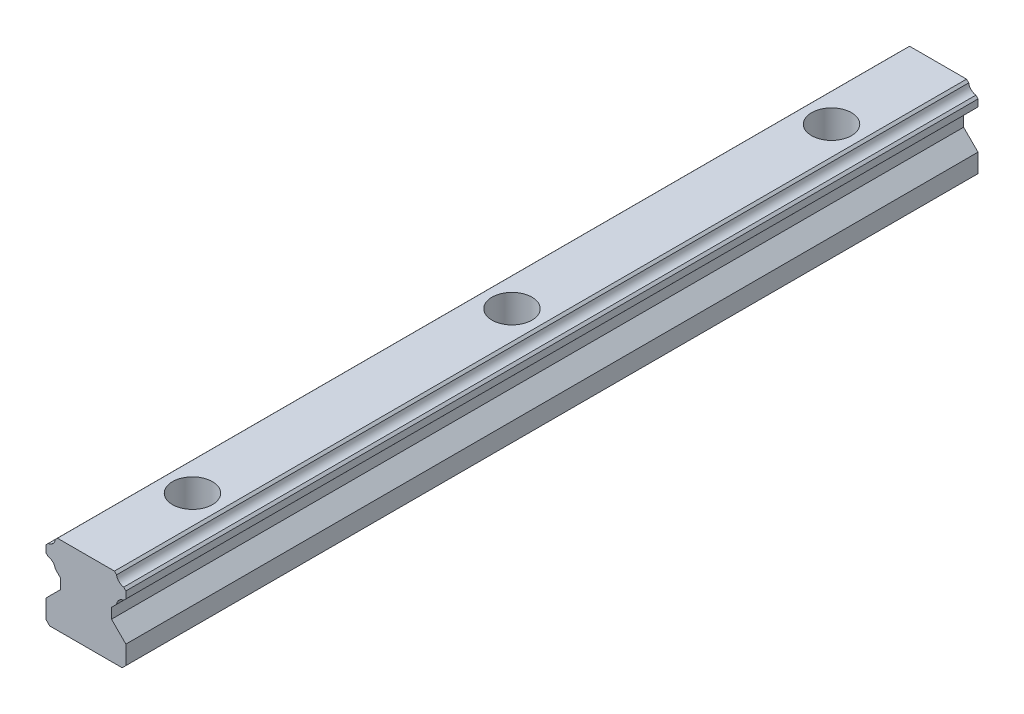
from build123d import *

# Parameters (mm, degrees)
EXTRUDE1_DEPTH  = 160
LPATTERN1_COUNT = 3
LPATTERN1_PITCH = 60


with BuildPart() as part:
    # Sketch1 → Extrude1 (new body)
    with BuildSketch(Plane(origin=(-20, 0, 0), x_dir=(1, 0, 0), z_dir=(0, 0, 1))):
        with BuildLine():
            Line((12.5, 0.69999271), (13.199992786, 0))
            Line((13.199992786, 0), (26.800007214, 0))
            Line((26.800007214, 0), (27.5, 0.69999271))
            Line((27.5, 0.69999271), (27.5, 4.2000246))
            Line((27.5, 4.2000246), (24.8000183, 6.9000063))
            Line((24.8000183, 6.9000063), (24.8000183, 8.8400054))
            Line((24.8000183, 8.8400054), (25.755946813, 9.794179118))
            ThreePointArc((25.755946813, 9.794179118), (26.198484624, 10.690600567), (27.09432569, 11.13431209))
            Line((27.09432569, 11.13431209), (27.5, 11.5399866))
            Line((27.5, 11.5399866), (27.5, 12.8500204))
            Line((27.5, 12.8500204), (27.09432569, 13.268442751))
            ThreePointArc((27.09432569, 13.268442751), (26.202460867, 13.706434947), (25.755946813, 14.594063938))
            Line((25.755946813, 14.594063938), (25.3500197, 15))
            Line((25.3500197, 15), (14.6499803, 15))
            Line((14.6499803, 15), (14.244053187, 14.594063938))
            ThreePointArc((14.244053187, 14.594063938), (13.797539133, 13.706434947), (12.90567431, 13.268442751))
            Line((12.90567431, 13.268442751), (12.5, 12.8500204))
            Line((12.5, 12.8500204), (12.5, 11.5399866))
            Line((12.5, 11.5399866), (12.90567431, 11.13431209))
            ThreePointArc((12.90567431, 11.13431209), (13.801515376, 10.690600567), (14.244053187, 9.794179118))
            Line((14.244053187, 9.794179118), (15.1999817, 8.8400054))
            Line((15.1999817, 8.8400054), (15.1999817, 6.9000063))
            Line((15.1999817, 6.9000063), (12.5, 4.2000246))
            Line((12.5, 4.2000246), (12.5, 0.69999271))
        make_face()
    extrude(amount=-EXTRUDE1_DEPTH)

    # Sketch2 → Cut-Revolve1 (revolve, cut)
    with BuildSketch(Plane(origin=(0, 0, 0), x_dir=(0, 0, -1), z_dir=(1, 0, 0)), mode=Mode.PRIVATE) as cut_revolve1_sk:
        Polygon((20, 15), (23.75, 15), (23.75, 9.7), (22.25, 9.7), (22.25, 0), (20, 0), align=None)
    cut_revolve1 = revolve(cut_revolve1_sk.sketch.rotate(Axis((0, 0, -20), (0, 1, 0)), 180), axis=Axis((0, 0, -20), (0, 1, 0)), mode=Mode.SUBTRACT)

    # LPattern1: Cut-Revolve1 ×3
    with Locations(*[(0, 0, -i * LPATTERN1_PITCH) for i in range(1, LPATTERN1_COUNT)]):
        add(cut_revolve1, mode=Mode.SUBTRACT)


solid = part.part
